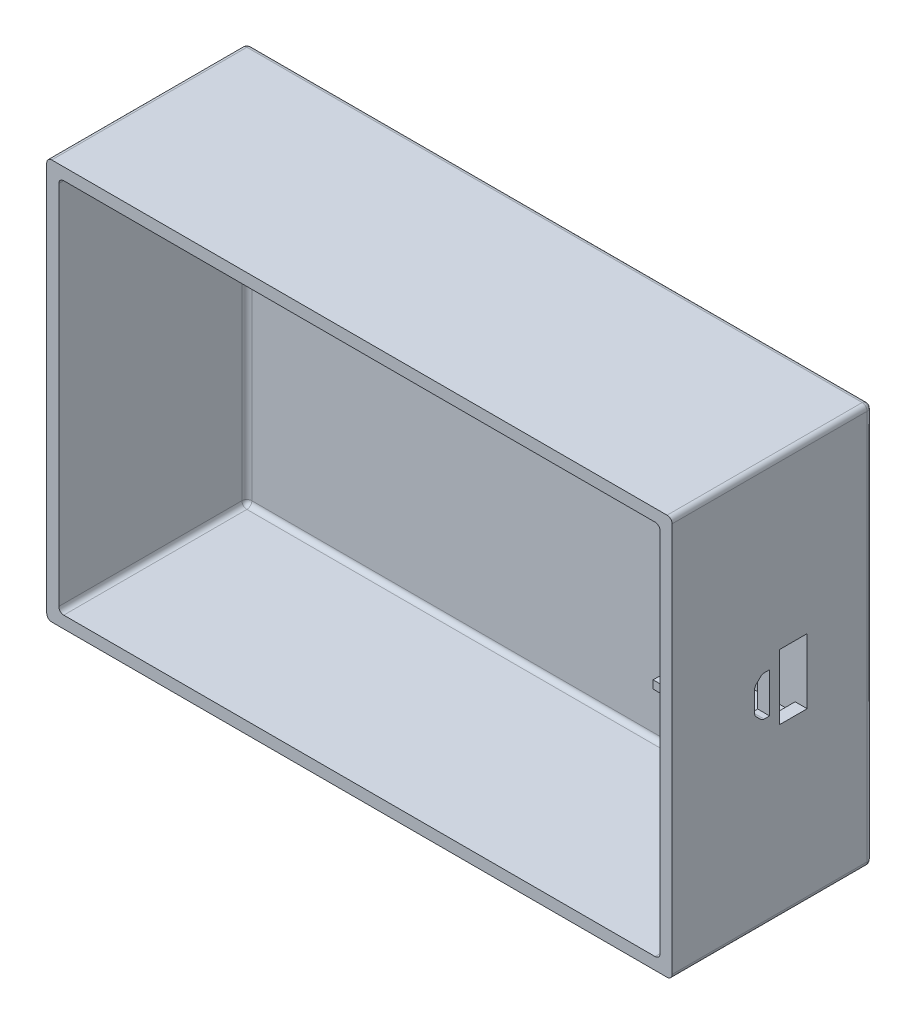
from build123d import *

# Parameters (mm, degrees)
SKETCH_1_W          = 125
SKETCH_1_H          = 80
EXTRUDE_1_DEPTH     = 40
SKETCH_2_W          = 120.2
SKETCH_2_H          = 75.2
CUT_EXTRUDE_1_DEPTH = 37.6
FILLET_1_R          = 1
FILLET_2_R          = 1
CUT_EXTRUDE_2_DEPTH = 0.5
SKETCH_4_W          = 5.5
SKETCH_4_H          = 13
CUT_EXTRUDE_3_DEPTH = 5
EXTRUDE_2_DEPTH     = 20
EXTRUDE_3_DEPTH     = 8


with BuildPart() as part:
    # Эскиз1 → Бобышка-Вытянуть1 (new body)
    with BuildSketch(Plane.XY):
        Rectangle(SKETCH_1_W, SKETCH_1_H)
    extrude(amount=EXTRUDE_1_DEPTH)

    # Эскиз2 → Вырез-Вытянуть1 (cut)
    with BuildSketch(Plane.XY.offset(40)):
        Rectangle(SKETCH_2_W, SKETCH_2_H)
    extrude(amount=-CUT_EXTRUDE_1_DEPTH, mode=Mode.SUBTRACT)

    # Скругление1
    fillet_1_edges = [part.edges().sort_by_distance(p)[0] for p in [
        (0, -40, 0),
        (-62.5, 0, 0),
        (0, 40, 0),
        (62.5, 0, 0),
        (62.5, -40, 20),
        (-62.5, -40, 20),
        (-62.5, 40, 20),
        (62.5, 40, 20),
    ]]
    fillet(fillet_1_edges, radius=FILLET_1_R)

    # Скругление2
    fillet_2_edges = [part.edges().sort_by_distance(p)[0] for p in [
        (60.1, 0, 2.4),
        (60.1, 37.6, 21.2),
        (0, -37.6, 2.4),
        (60.1, -37.6, 21.2),
        (-60.1, 0, 2.4),
        (-60.1, -37.6, 21.2),
        (0, 37.6, 2.4),
        (-60.1, 37.6, 21.2),
    ]]
    fillet(fillet_2_edges, radius=FILLET_2_R)

    # Эскиз3 → Вырез-Вытянуть2 (cut)
    # profile 1 of 6: a face of its own
    with BuildSketch(Plane(origin=(0, 0, 0), x_dir=(-1, 0, 0), z_dir=(0, 0, -1))):
        with BuildLine():
            Line((-35.743589744, 25), (-16.769230769, 25))
            Line((-16.769230769, 25), (-16.769230769, 8.333333333))
            Line((-16.769230769, 8.333333333), (-14.461538462, 8.333333333))
            Line((-14.461538462, 8.333333333), (-14.461538462, 0.641025641))
            Line((-14.461538462, 0.641025641), (-19.076923077, 0.641025641))
            Line((-19.076923077, 0.641025641), (-19.076923077, 5))
            Line((-19.076923077, 5), (-36.256410256, 5))
            Line((-36.256410256, 5), (-36.256410256, 0.641025641))
            Line((-36.256410256, 0.641025641), (-40.871794872, 0.641025641))
            Line((-40.871794872, 0.641025641), (-40.871794872, 8.333333333))
            Line((-40.871794872, 8.333333333), (-38.564102564, 8.333333333))
            add(Edge.make_bspline(
                [(-38.564102564, 8.333333333), (-38.423939227, 8.549412333), (-38.142564623, 8.983185846), (-37.766294395, 9.665700543), (-37.432031298, 10.377061568), (-37.124908802, 11.109271034), (-36.861959465, 11.86880581), (-36.632590424, 12.652158986), (-36.440496869, 13.462613095), (-36.284618524, 14.305421659), (-36.158953799, 15.1895625), (-36.044974298, 16.123005325), (-35.956693481, 17.113449057), (-35.874111033, 18.158890462), (-35.81488608, 19.259665772), (-35.777871569, 20.41649224), (-35.746447147, 21.629106486), (-35.744556365, 22.457242257), (-35.743589744, 22.880608974)],
                knots=[0, 0, 0, 0, 0.821752742, 1.649649308, 2.484634787, 3.329137309, 4.182327301, 5.048164878, 5.93303002, 6.839131783, 7.782388066, 8.782543542, 9.83977442, 10.955378249, 12.129129161, 13.357281614, 14.648966693, 16, 16, 16, 16], degree=3))
            Line((-35.743589744, 22.880608974), (-35.743589744, 25))
        make_face()
        with BuildLine():
            add(Edge.make_bspline(
                [(-30.102564103, 21.666666667), (-30.105207991, 21.29271776), (-30.110411753, 20.556702847), (-30.141427896, 19.471929174), (-30.198903671, 18.424816315), (-30.272504924, 17.415920166), (-30.374193999, 16.446325596), (-30.491872073, 15.51592918), (-30.638063507, 14.625283032), (-30.799382741, 13.771919733), (-30.989770134, 12.957530565), (-31.195203978, 12.179846934), (-31.428955472, 11.442789154), (-31.67921883, 10.743548847), (-31.957780404, 10.085663181), (-32.252123153, 9.463377077), (-32.572763759, 8.880432264), (-32.807560893, 8.513739619), (-32.923076923, 8.333333333)],
                knots=[0, 0, 0, 0, 1.299711557, 2.558122435, 3.771311303, 4.944304467, 6.073539971, 7.159347729, 8.2032346, 9.21003606, 10.177197405, 11.109446499, 12.004918904, 12.86385847, 13.689704149, 14.486931871, 15.255597286, 16, 16, 16, 16], degree=3))
            Line((-32.923076923, 8.333333333), (-22.41025641, 8.333333333))
            Line((-22.41025641, 8.333333333), (-22.41025641, 21.666666667))
            Line((-22.41025641, 21.666666667), (-30.102564103, 21.666666667))
        make_face(mode=Mode.SUBTRACT)
    # profile 2 of 6: a face of its own
    with BuildSketch(Plane(origin=(0, 0, 0), x_dir=(-1, 0, 0), z_dir=(0, 0, -1))):
        with BuildLine():
            Line((-6.769230769, 19.615384615), (10.923076923, 19.615384615))
            Line((10.923076923, 19.615384615), (10.923076923, 5))
            Line((10.923076923, 5), (5.538461538, 5))
            Line((5.538461538, 5), (5.538461538, 16.794871795))
            Line((5.538461538, 16.794871795), (-1.384615385, 16.794871795))
            Line((-1.384615385, 16.794871795), (-1.384615385, 10.048076923))
            add(Edge.make_bspline(
                [(-1.384615385, 10.048076923), (-1.386370161, 9.841005653), (-1.38974751, 9.442463754), (-1.43061393, 8.870145363), (-1.494144698, 8.34584416), (-1.579398924, 7.868380094), (-1.695415169, 7.438246181), (-1.834985273, 7.055656363), (-1.996839462, 6.717891165), (-2.252556904, 6.348388821), (-2.599413454, 5.95961178), (-3.040930933, 5.569462975), (-3.506716493, 5.266068316), (-3.922573615, 5.087374577), (-4.279996587, 4.985410882), (-4.584520837, 4.923820444), (-4.925339923, 4.868085771), (-5.303339715, 4.819468858), (-5.719065582, 4.784317372), (-6.173424849, 4.761999434), (-6.66492972, 4.74448371), (-7.005591152, 4.743894614), (-7.181891026, 4.743589744)],
                knots=[0, 0, 0, 0, 1.340868013, 2.580715734, 3.713588199, 4.760277271, 5.719123454, 6.594782291, 7.395470463, 8.136727625, 9.497147129, 10.759921788, 11.942705723, 13.081801271, 13.675827936, 14.347571739, 15.09265399, 15.912271391, 16.815144, 17.793873759, 18.858280561, 20, 20, 20, 20], degree=3))
            add(Edge.make_bspline(
                [(-7.181891026, 4.743589744), (-7.415650966, 4.747392526), (-7.919565879, 4.755590162), (-8.726395682, 4.803139599), (-9.6373807, 4.875198272), (-10.277639615, 4.941163836), (-10.615384615, 4.975961538)],
                knots=[0, 0, 0, 0, 0.814839079, 1.756543752, 2.816547317, 4, 4, 4, 4], degree=3))
            Line((-10.615384615, 4.975961538), (-10.615384615, 7.632211538))
            add(Edge.make_bspline(
                [(-10.615384615, 7.632211538), (-10.573976604, 7.632599088), (-10.46839733, 7.633587234), (-10.274920677, 7.621528064), (-10.01169784, 7.616593056), (-9.812753781, 7.60861256), (-9.701923077, 7.604166667)],
                knots=[0, 0, 0, 0, 0.543558918, 1.385928807, 2.543714495, 4, 4, 4, 4], degree=3))
            add(Edge.make_bspline(
                [(-9.701923077, 7.604166667), (-9.567046398, 7.598670355), (-9.314677242, 7.588386148), (-8.959441482, 7.576196167), (-8.653612273, 7.567804294), (-8.465281239, 7.565258133), (-8.379807692, 7.564102564)],
                knots=[0, 0, 0, 0, 1.224593261, 2.291349178, 3.224533305, 4, 4, 4, 4], degree=3))
            add(Edge.make_bspline(
                [(-8.379807692, 7.564102564), (-8.291590958, 7.565426279), (-8.124143446, 7.567938873), (-7.887114826, 7.592227139), (-7.675268101, 7.629808654), (-7.492442649, 7.691413303), (-7.330943187, 7.760407834), (-7.202745141, 7.855983674), (-7.092779049, 7.959939288), (-7.013277733, 8.094684363), (-6.952603688, 8.265829128), (-6.902374207, 8.486265686), (-6.866005406, 8.765472969), (-6.829145485, 9.100603944), (-6.8024436, 9.494898751), (-6.782984025, 9.947747754), (-6.77124658, 10.459341107), (-6.769925485, 10.819972464), (-6.769230769, 11.009615385)],
                knots=[0, 0, 0, 0, 0.945825259, 1.795306607, 2.553808499, 3.246864566, 3.862134721, 4.426621001, 4.953312137, 5.474127026, 6.086053296, 6.895587344, 7.894276821, 9.104388665, 10.511727968, 12.131936209, 13.965925869, 16, 16, 16, 16], degree=3))
            Line((-6.769230769, 11.009615385), (-6.769230769, 19.615384615))
        make_face()
    # profile 3 of 6: a face of its own
    with BuildSketch(Plane(origin=(0, 0, 0), x_dir=(-1, 0, 0), z_dir=(0, 0, -1))):
        with BuildLine():
            Line((36.307692308, 19.615384615), (36.307692308, 5))
            Line((36.307692308, 5), (30.923076923, 5))
            Line((30.923076923, 5), (30.923076923, 10.897435897))
            Line((30.923076923, 10.897435897), (30.442307692, 10.897435897))
            add(Edge.make_bspline(
                [(30.442307692, 10.897435897), (30.307399621, 10.897151422), (30.046826075, 10.896601959), (29.670188735, 10.878786198), (29.321149692, 10.857179984), (28.999333026, 10.819720812), (28.705075449, 10.777158295), (28.437287536, 10.725270029), (28.1980981, 10.663527257), (27.910508572, 10.557392241), (27.557194418, 10.378942568), (27.133007286, 10.085344805), (26.686965142, 9.704754922), (26.39738786, 9.40826878), (26.243589744, 9.250801282)],
                knots=[0, 0, 0, 0, 1.033741574, 1.996661172, 2.889183176, 3.71311321, 4.478792633, 5.167252479, 5.802785083, 6.36939551, 7.51365449, 8.825117058, 10.313779961, 12, 12, 12, 12], degree=3))
            Line((26.243589744, 9.250801282), (25.931089744, 8.970352564))
            Line((25.931089744, 8.970352564), (22.521634615, 5))
            Line((22.521634615, 5), (16.051282051, 5))
            Line((16.051282051, 5), (19.869391026, 9.118589744))
            add(Edge.make_bspline(
                [(19.869391026, 9.118589744), (20.001762801, 9.261255835), (20.258115196, 9.537544298), (20.648290221, 9.919420288), (21.035634938, 10.247074836), (21.405655041, 10.535862655), (21.773494046, 10.768929021), (22.128906731, 10.958260179), (22.475435678, 11.10435537), (22.709047041, 11.162002517), (22.822115385, 11.189903846)],
                knots=[0, 0, 0, 0, 1.275536761, 2.470216209, 3.575314176, 4.599451856, 5.544004934, 6.42497539, 7.237685091, 8, 8, 8, 8], degree=3))
            add(Edge.make_bspline(
                [(22.822115385, 11.189903846), (22.641518472, 11.200241167), (22.288285741, 11.220460118), (21.773845596, 11.301149545), (21.282393179, 11.401534395), (20.81805521, 11.543209505), (20.37800364, 11.713617163), (19.969160249, 11.925493152), (19.580470911, 12.161093522), (19.222284482, 12.432368704), (18.899138247, 12.729511223), (18.619134069, 13.05196172), (18.376047618, 13.389995098), (18.185803336, 13.754766021), (18.028156058, 14.132619326), (17.928534492, 14.535482873), (17.854749614, 14.954564262), (17.849043353, 15.242711354), (17.846153846, 15.388621795)],
                knots=[0, 0, 0, 0, 1.197713301, 2.342628858, 3.446289809, 4.518324156, 5.55505531, 6.568031173, 7.564999682, 8.563027648, 9.539728277, 10.46776829, 11.388312886, 12.290779309, 13.187851591, 14.093478572, 15.034585495, 16, 16, 16, 16], degree=3))
            add(Edge.make_bspline(
                [(17.846153846, 15.388621795), (17.84986642, 15.506235897), (17.857186009, 15.73812003), (17.896227608, 16.080488652), (17.968262298, 16.410881405), (18.073773969, 16.726258135), (18.202255675, 17.029857481), (18.359145211, 17.320545393), (18.547830608, 17.596518448), (18.838471569, 17.944606589), (19.259410649, 18.338104616), (19.843541411, 18.72862787), (20.501337161, 19.041753739), (21.110327599, 19.222558711), (21.645005762, 19.336751114), (22.099600849, 19.412413265), (22.599513637, 19.475425061), (23.145997462, 19.527078884), (23.739177239, 19.566924409), (24.379122479, 19.592605917), (25.065544672, 19.61566154), (25.538438959, 19.615478974), (25.782852564, 19.615384615)],
                knots=[0, 0, 0, 0, 0.696101467, 1.37241099, 2.03580972, 2.693014292, 3.337361357, 3.984416181, 4.644133792, 5.311895028, 6.664837187, 8.03682209, 9.4542059, 10.958925535, 11.783473158, 12.688943128, 13.684762593, 14.764344718, 15.936519858, 17.202062861, 18.553896884, 20, 20, 20, 20], degree=3))
            Line((25.782852564, 19.615384615), (36.307692308, 19.615384615))
        make_face()
        with BuildLine():
            Line((30.923076923, 17.051282051), (27.076923077, 17.051282051))
            add(Edge.make_bspline(
                [(27.076923077, 17.051282051), (26.905996475, 17.048899722), (26.578760076, 17.044338788), (26.106606943, 17.033184254), (25.675641451, 16.992752503), (25.281631588, 16.953966909), (24.9285937, 16.889575039), (24.611175678, 16.828965569), (24.337725871, 16.735931207), (24.097316825, 16.6437899), (23.892923626, 16.527820601), (23.715280376, 16.40056762), (23.563194765, 16.254958495), (23.443354858, 16.087761874), (23.345189571, 15.906732234), (23.277389431, 15.707733437), (23.235972557, 15.491851364), (23.232545914, 15.342078774), (23.230769231, 15.264423077)],
                knots=[0, 0, 0, 0, 1.72653821, 3.305431345, 4.767069014, 6.097088554, 7.301057069, 8.390914795, 9.354829622, 10.213874238, 10.986759081, 11.720527595, 12.416772168, 13.101956177, 13.789789786, 14.489292424, 15.216712155, 16, 16, 16, 16], degree=3))
            add(Edge.make_bspline(
                [(23.230769231, 15.264423077), (23.234066472, 15.186774114), (23.24048918, 15.03552144), (23.283967448, 14.817271269), (23.361319764, 14.616667262), (23.471675391, 14.43534563), (23.609450095, 14.267853127), (23.780302633, 14.120617549), (23.977909147, 13.98586699), (24.21172281, 13.875246803), (24.476496024, 13.774402013), (24.781436543, 13.691357307), (25.124210356, 13.621164406), (25.505024382, 13.560392522), (25.923798032, 13.518284817), (26.380747422, 13.486536424), (26.877767111, 13.46659453), (27.222470584, 13.463266428), (27.401442308, 13.461538462)],
                knots=[0, 0, 0, 0, 0.738505747, 1.438537798, 2.106124022, 2.772742729, 3.449332141, 4.160342169, 4.910768808, 5.717464319, 6.613971556, 7.603314207, 8.719416959, 9.941122083, 11.269570315, 12.721237693, 14.297650627, 16, 16, 16, 16], degree=3))
            Line((27.401442308, 13.461538462), (30.923076923, 13.461538462))
            Line((30.923076923, 13.461538462), (30.923076923, 17.051282051))
        make_face(mode=Mode.SUBTRACT)
    # profile 4 of 6: a face of its own
    with BuildSketch(Plane(origin=(0, 0, 0), x_dir=(-1, 0, 0), z_dir=(0, 0, -1))):
        with BuildLine():
            Line((-34.717948718, -13.435897436), (-40.358974359, -12.41025641))
            add(Edge.make_bspline(
                [(-40.358974359, -12.41025641), (-40.279888714, -12.212281851), (-40.123180431, -11.819995065), (-39.824596185, -11.264789738), (-39.473257502, -10.748721575), (-39.071886882, -10.269382885), (-38.615068822, -9.832608888), (-38.112910799, -9.428726776), (-37.555504013, -9.068543612), (-36.950048281, -8.743834924), (-36.291523478, -8.459016914), (-35.583204479, -8.211470242), (-34.823441259, -8.00531936), (-34.014729969, -7.831199531), (-33.153988448, -7.702683564), (-32.242502948, -7.605647167), (-31.279796888, -7.550450104), (-30.620794788, -7.542525399), (-30.282852564, -7.538461538)],
                knots=[0, 0, 0, 0, 0.854963274, 1.694110579, 2.523498924, 3.356480554, 4.197849411, 5.055696551, 5.938603418, 6.856874247, 7.809648952, 8.814687402, 9.865160438, 10.966677751, 12.132340193, 13.355597085, 14.64392632, 16, 16, 16, 16], degree=3))
            add(Edge.make_bspline(
                [(-30.282852564, -7.538461538), (-29.886140206, -7.543327819), (-29.116143664, -7.552772997), (-27.997901433, -7.618209544), (-26.955224811, -7.739470356), (-25.986985253, -7.899852711), (-25.095936172, -8.112834478), (-24.277433799, -8.364925409), (-23.537251789, -8.675528927), (-22.871834144, -9.02543604), (-22.287338367, -9.412388921), (-21.772813101, -9.811748302), (-21.339189582, -10.23250413), (-20.978426207, -10.667325297), (-20.704840189, -11.123900015), (-20.502714606, -11.594339884), (-20.382928814, -12.085145966), (-20.366979876, -12.418974385), (-20.358974359, -12.586538462)],
                knots=[0, 0, 0, 0, 1.560831493, 3.029486796, 4.404656358, 5.689125062, 6.888349997, 8.006716197, 9.054738793, 10.041923272, 10.960020323, 11.809342296, 12.600783475, 13.332767086, 14.025711206, 14.687350788, 15.341120049, 16, 16, 16, 16], degree=3))
            add(Edge.make_bspline(
                [(-20.358974359, -12.586538462), (-20.361337627, -12.701638042), (-20.366038518, -12.93058812), (-20.425728987, -13.267345057), (-20.515382796, -13.595333055), (-20.632566215, -13.917726506), (-20.798631199, -14.226638168), (-20.988353184, -14.532584419), (-21.220311722, -14.825826159), (-21.485612679, -15.11118187), (-21.787558943, -15.386059219), (-22.119902697, -15.656690099), (-22.492637343, -15.91129771), (-22.895298726, -16.165518825), (-23.339623606, -16.403309814), (-23.81465449, -16.641501272), (-24.328169129, -16.864052443), (-24.684103449, -17.002760293), (-24.866185897, -17.073717949)],
                knots=[0, 0, 0, 0, 0.814746678, 1.620651567, 2.414971373, 3.223538951, 4.044690925, 4.89535986, 5.771851774, 6.689232278, 7.6536808, 8.663137878, 9.723733213, 10.850255578, 12.03603721, 13.293018467, 14.615211302, 16, 16, 16, 16], degree=3))
            add(Edge.make_bspline(
                [(-24.866185897, -17.073717949), (-24.642551872, -17.131658106), (-24.205869802, -17.244795754), (-23.578112664, -17.446110324), (-22.992175464, -17.66164215), (-22.449180638, -17.892924114), (-21.95077366, -18.145040118), (-21.497166871, -18.417448588), (-21.086618975, -18.70733332), (-20.714897212, -19.010593311), (-20.390091893, -19.336418248), (-20.105499414, -19.678060634), (-19.870184027, -20.041539283), (-19.668033888, -20.419573496), (-19.523715731, -20.821847659), (-19.41414188, -21.238508906), (-19.342207847, -21.673265842), (-19.336324836, -21.970600609), (-19.333333333, -22.121794872)],
                knots=[0, 0, 0, 0, 1.363670452, 2.66278996, 3.890135407, 5.048615163, 6.145236149, 7.185059184, 8.169449617, 9.110314329, 10.013489942, 10.881676504, 11.73016355, 12.565953945, 13.406638985, 14.246177088, 15.108183796, 16, 16, 16, 16], degree=3))
            add(Edge.make_bspline(
                [(-19.333333333, -22.121794872), (-19.34219292, -22.338721231), (-19.359623789, -22.765514816), (-19.486158134, -23.389801465), (-19.699655411, -23.979815894), (-20.003479317, -24.535722537), (-20.384808741, -25.063023406), (-20.856483893, -25.554068042), (-21.410048049, -26.011750477), (-22.045952332, -26.436069992), (-22.763856152, -26.823231581), (-23.572827995, -27.146506025), (-24.457746674, -27.43329656), (-25.430352003, -27.656961645), (-26.483986126, -27.839018077), (-27.623277698, -27.955489165), (-28.844573529, -28.041589814), (-29.68706099, -28.04797905), (-30.122596154, -28.051282051)],
                knots=[0, 0, 0, 0, 0.761550587, 1.498319087, 2.226800592, 2.957091617, 3.716052601, 4.505611972, 5.341521545, 6.233879613, 7.186530315, 8.200336361, 9.2890326, 10.450538317, 11.701968329, 13.041876955, 14.470758718, 16, 16, 16, 16], degree=3))
            add(Edge.make_bspline(
                [(-30.122596154, -28.051282051), (-30.47922512, -28.048399954), (-31.172791318, -28.042794897), (-32.184367883, -27.993865829), (-33.137399769, -27.915524456), (-34.034333551, -27.803358598), (-34.873131887, -27.661663465), (-35.654354556, -27.485444483), (-36.377148558, -27.277753748), (-37.048641559, -27.038183079), (-37.672738835, -26.754372324), (-38.249594856, -26.409118161), (-38.790643325, -26.012474382), (-39.285470856, -25.55254762), (-39.74774232, -25.043665106), (-40.168053679, -24.477778506), (-40.546671206, -23.85275982), (-40.761891227, -23.407077863), (-40.871794872, -23.179487179)],
                knots=[0, 0, 0, 0, 1.358105267, 2.641220975, 3.855947254, 4.999023033, 6.082656065, 7.094392619, 8.047302311, 8.945029315, 9.807501762, 10.653577828, 11.500921721, 12.357601304, 13.221796556, 14.115914563, 15.037878278, 16, 16, 16, 16], degree=3))
            Line((-40.871794872, -23.179487179), (-35.230769231, -21.897435897))
            add(Edge.make_bspline(
                [(-35.230769231, -21.897435897), (-35.164864579, -22.040119435), (-35.036972508, -22.317005702), (-34.814744291, -22.701250926), (-34.582508183, -23.050670382), (-34.330222025, -23.359269716), (-34.061252106, -23.630105247), (-33.775832347, -23.859067351), (-33.475589585, -24.051480288), (-33.045322492, -24.254715491), (-32.455463654, -24.443407345), (-31.690741244, -24.599458273), (-30.851890457, -24.703206088), (-30.267159797, -24.712896899), (-29.962339744, -24.717948718)],
                knots=[0, 0, 0, 0, 0.879662781, 1.707040261, 2.48275382, 3.226747029, 3.935320759, 4.616203792, 5.271770941, 5.92733809, 7.275276667, 8.727274345, 10.293928337, 12, 12, 12, 12], degree=3))
            add(Edge.make_bspline(
                [(-29.962339744, -24.717948718), (-29.752607711, -24.716081473), (-29.34741697, -24.712474058), (-28.761517863, -24.672552788), (-28.219962365, -24.604443165), (-27.721504422, -24.514248792), (-27.267648765, -24.396277968), (-26.859942466, -24.245683633), (-26.491954415, -24.076684888), (-26.171812783, -23.87334195), (-25.889092423, -23.65828825), (-25.649755199, -23.426688897), (-25.437899403, -23.196594121), (-25.267641815, -22.954451306), (-25.138000643, -22.703265605), (-25.045081142, -22.444727275), (-24.986547665, -22.177803472), (-24.978436124, -21.996552113), (-24.974358974, -21.905448718)],
                knots=[0, 0, 0, 0, 1.589407083, 3.070646972, 4.447876576, 5.724383153, 6.907764151, 7.996500943, 9.015235275, 9.97012061, 10.86496701, 11.702630916, 12.491089718, 13.232400992, 13.938607157, 14.62696155, 15.309861917, 16, 16, 16, 16], degree=3))
            add(Edge.make_bspline(
                [(-24.974358974, -21.905448718), (-24.977185169, -21.800812842), (-24.982721604, -21.595834118), (-25.057033741, -21.298463192), (-25.163837937, -21.015305327), (-25.318548133, -20.746791529), (-25.522022155, -20.499046745), (-25.766027972, -20.264659447), (-26.050841997, -20.043795869), (-26.382146941, -19.843828141), (-26.756950734, -19.664570721), (-27.173878886, -19.502838344), (-27.639116601, -19.373945918), (-28.145430623, -19.260748798), (-28.698552892, -19.17857874), (-29.293548726, -19.119746255), (-29.933839129, -19.083141737), (-30.374949313, -19.07904464), (-30.603365385, -19.076923077)],
                knots=[0, 0, 0, 0, 0.720237758, 1.410925408, 2.102288907, 2.8040751, 3.53803513, 4.307024266, 5.134623217, 6.019637888, 6.971676192, 7.998466297, 9.100947845, 10.299346042, 11.576533089, 12.956493832, 14.424008909, 16, 16, 16, 16], degree=3))
            Line((-30.603365385, -19.076923077), (-31.897435897, -19.076923077))
            Line((-31.897435897, -19.076923077), (-31.897435897, -16.256410256))
            Line((-31.897435897, -16.256410256), (-31.260416667, -16.256410256))
            add(Edge.make_bspline(
                [(-31.260416667, -16.256410256), (-31.053371951, -16.254163917), (-30.652303845, -16.249812515), (-30.06912, -16.214628737), (-29.523538808, -16.15063126), (-29.015571754, -16.062395287), (-28.543382717, -15.956297153), (-28.10955251, -15.821818016), (-27.716184058, -15.655005569), (-27.356740735, -15.473621183), (-27.04071896, -15.263618195), (-26.761441834, -15.040934281), (-26.527379751, -14.797556202), (-26.330712732, -14.542186656), (-26.187161753, -14.263481765), (-26.076168964, -13.974266207), (-26.010242498, -13.665870219), (-26.003449891, -13.454903902), (-26, -13.34775641)],
                knots=[0, 0, 0, 0, 1.49029937, 2.886871774, 4.203260901, 5.442298604, 6.596583465, 7.685023486, 8.706224579, 9.669304773, 10.578486423, 11.432749348, 12.234962671, 13.00400541, 13.743647033, 14.482851238, 15.229456688, 16, 16, 16, 16], degree=3))
            add(Edge.make_bspline(
                [(-26, -13.34775641), (-26.002657045, -13.262006039), (-26.007898417, -13.092852173), (-26.062693177, -12.844395413), (-26.151326328, -12.607521106), (-26.273020507, -12.381463295), (-26.427682447, -12.164618374), (-26.622509455, -11.962580188), (-26.84674032, -11.76554819), (-27.104228296, -11.58164944), (-27.392348739, -11.411962923), (-27.715000963, -11.270323592), (-28.063833247, -11.144754497), (-28.443740911, -11.046212492), (-28.851598414, -10.965803586), (-29.29064645, -10.910454572), (-29.758891281, -10.879344098), (-30.081149732, -10.874357863), (-30.246794872, -10.871794872)],
                knots=[0, 0, 0, 0, 0.755897194, 1.491106475, 2.233369413, 2.982248597, 3.750996372, 4.576569761, 5.453718901, 6.382796318, 7.365372167, 8.399486862, 9.488193061, 10.634773957, 11.860034556, 13.155469815, 14.53787356, 16, 16, 16, 16], degree=3))
            add(Edge.make_bspline(
                [(-30.246794872, -10.871794872), (-30.525046884, -10.878791792), (-31.059003616, -10.892218658), (-31.820905554, -11.01278056), (-32.505985972, -11.210248997), (-33.112579876, -11.492918138), (-33.642114412, -11.856230487), (-34.089106085, -12.304751844), (-34.457900174, -12.833933767), (-34.629878846, -13.23203218), (-34.717948718, -13.435897436)],
                knots=[0, 0, 0, 0, 1.208751061, 2.319554717, 3.342564807, 4.298139982, 5.215927623, 6.118911266, 7.036698907, 8, 8, 8, 8], degree=3))
        make_face()
    # profile 5 of 6: a face of its own
    with BuildSketch(Plane(origin=(0, 0, 0), x_dir=(-1, 0, 0), z_dir=(0, 0, -1))):
        with BuildLine():
            Line((5.538461538, -20.358974359), (10.923076923, -21.641025641))
            add(Edge.make_bspline(
                [(10.923076923, -21.641025641), (10.81529284, -21.894182514), (10.602316992, -22.39440758), (10.209502766, -23.101079081), (9.769395007, -23.76078208), (9.274710933, -24.368887236), (8.726284423, -24.922721266), (8.130385764, -25.432019635), (7.480276617, -25.887854403), (6.778558823, -26.293771349), (6.028548068, -26.650981465), (5.226982721, -26.953172239), (4.380512144, -27.215056525), (3.483102818, -27.425054742), (2.539333377, -27.594899142), (1.544863591, -27.706984942), (0.503565425, -27.782201779), (-0.207925898, -27.790588399), (-0.571314103, -27.794871795)],
                knots=[0, 0, 0, 0, 0.947346957, 1.871909256, 2.78043276, 3.676452459, 4.567853774, 5.462099994, 6.373461405, 7.299076215, 8.251881505, 9.231922012, 10.247692588, 11.302232216, 12.405063169, 13.54924748, 14.748298777, 16, 16, 16, 16], degree=3))
            add(Edge.make_bspline(
                [(-0.571314103, -27.794871795), (-1.020371377, -27.788263465), (-1.900374344, -27.775313335), (-3.189268194, -27.641914822), (-4.417310043, -27.436394049), (-5.586875999, -27.149031652), (-6.692411397, -26.772728533), (-7.738187396, -26.313290823), (-8.722646169, -25.772706036), (-9.489182, -25.25034721), (-10.063213062, -24.796675284), (-10.46421467, -24.437892061), (-10.842333301, -24.068092336), (-11.185290816, -23.675873023), (-11.509188937, -23.277547156), (-11.79674912, -22.857059356), (-12.062660639, -22.425114423), (-12.299239976, -21.975257008), (-12.507045242, -21.51058088), (-12.688372592, -21.031882176), (-12.841432239, -20.536916696), (-12.963593763, -20.026725743), (-13.061840582, -19.501360142), (-13.126930322, -18.960618073), (-13.1749811, -18.404706105), (-13.177975942, -18.028686761), (-13.179487179, -17.838942308)],
                knots=[0, 0, 0, 0, 1.791237332, 3.510229671, 5.16418935, 6.756428933, 8.310109429, 9.818019681, 11.308628788, 12.785141417, 13.513323979, 14.226674063, 14.931293169, 15.622074919, 16.304481995, 16.97851566, 17.652970464, 18.327530513, 19.004925963, 19.682866128, 20.368863042, 21.070655585, 21.775093325, 22.500149618, 23.243155183, 24, 24, 24, 24], degree=3))
            add(Edge.make_bspline(
                [(-13.179487179, -17.838942308), (-13.177994221, -17.638520227), (-13.175044288, -17.242506874), (-13.127030177, -16.657207517), (-13.061192554, -16.087290861), (-12.965191896, -15.534789553), (-12.840681266, -14.999765615), (-12.688337376, -14.482028012), (-12.508150802, -13.980130694), (-12.299242377, -13.496598546), (-12.067617902, -13.027527323), (-11.800426566, -12.580900187), (-11.514658858, -12.144605776), (-11.189363138, -11.733702311), (-10.847526003, -11.331275915), (-10.473649574, -10.950155812), (-10.06968618, -10.589396427), (-9.499127495, -10.123172745), (-8.724126748, -9.597567618), (-7.732888216, -9.040531459), (-6.667700521, -8.575605295), (-5.534495436, -8.195649971), (-4.331057145, -7.899624825), (-3.058791077, -7.688631343), (-1.71694851, -7.564538493), (-0.799941642, -7.547285666), (-0.330929487, -7.538461538)],
                knots=[0, 0, 0, 0, 0.77664363, 1.53456768, 2.274892301, 2.999984421, 3.706925311, 4.403075492, 5.090802435, 5.772561366, 6.443923248, 7.116879817, 7.788800269, 8.463923535, 9.146684028, 9.834878389, 10.531317209, 11.245198673, 12.689680356, 14.15432575, 15.647051531, 17.187458641, 18.781957291, 20.445713313, 22.182125224, 24, 24, 24, 24], degree=3))
            add(Edge.make_bspline(
                [(-0.330929487, -7.538461538), (0.079234612, -7.545920299), (0.882111914, -7.560520479), (2.056397958, -7.658792905), (3.170546607, -7.833336156), (4.227473367, -8.065284509), (5.225083333, -8.375825904), (6.163932836, -8.751225104), (7.045823013, -9.194847745), (7.588806649, -9.549849993), (7.858173077, -9.725961538)],
                knots=[0, 0, 0, 0, 1.143684331, 2.238709315, 3.282544038, 4.286232804, 5.25321281, 6.192249358, 7.10320072, 8, 8, 8, 8], degree=3))
            add(Edge.make_bspline(
                [(7.858173077, -9.725961538), (8.01105294, -9.836969592), (8.317110581, -10.059202019), (8.740548416, -10.437684201), (9.135425873, -10.850117433), (9.506412255, -11.29437436), (9.841576261, -11.779979349), (10.144581056, -12.300546434), (10.430796481, -12.849622639), (10.58709688, -13.238120169), (10.666666667, -13.435897436)],
                knots=[0, 0, 0, 0, 0.959372778, 1.920615073, 2.880323673, 3.858489671, 4.857885176, 5.873727477, 6.917552015, 8, 8, 8, 8], degree=3))
            Line((10.666666667, -13.435897436), (5.282051282, -14.205128205))
            add(Edge.make_bspline(
                [(5.282051282, -14.205128205), (5.237718519, -14.078629948), (5.149698829, -13.827476248), (4.975399199, -13.468787551), (4.767365777, -13.13171712), (4.522818976, -12.817653932), (4.25209374, -12.518374711), (3.938702006, -12.247648427), (3.599305249, -11.988148184), (3.222469204, -11.759406292), (2.820949592, -11.550649265), (2.397628263, -11.365551348), (1.950735875, -11.21403121), (1.483173256, -11.090752041), (0.995578124, -10.988336248), (0.484968036, -10.92435963), (-0.04421476, -10.876019539), (-0.40426051, -10.873218943), (-0.587339744, -10.871794872)],
                knots=[0, 0, 0, 0, 0.889498384, 1.76603865, 2.642130213, 3.514804097, 4.406024819, 5.317012614, 6.260567101, 7.240067246, 8.23959494, 9.264297334, 10.304726928, 11.369512207, 12.473887005, 13.61016531, 14.784795815, 16, 16, 16, 16], degree=3))
            add(Edge.make_bspline(
                [(-0.587339744, -10.871794872), (-0.839984004, -10.875623477), (-1.333128113, -10.883096648), (-2.054188853, -10.964406562), (-2.739825395, -11.07977313), (-3.389164767, -11.252542065), (-3.998884287, -11.479099888), (-4.576874528, -11.74591799), (-5.114686119, -12.069510872), (-5.61873797, -12.436459126), (-6.075890079, -12.860384378), (-6.466506874, -13.353172632), (-6.802327831, -13.902475841), (-7.074019119, -14.514254313), (-7.280769125, -15.187443868), (-7.433592223, -15.91937315), (-7.519065924, -16.713792899), (-7.531862239, -17.263156998), (-7.538461538, -17.546474359)],
                knots=[0, 0, 0, 0, 1.101135447, 2.149340177, 3.160311962, 4.130706059, 5.073989307, 5.993572482, 6.902361748, 7.806156036, 8.708373151, 9.611435522, 10.539223606, 11.508883602, 12.521849135, 13.604522201, 14.764607206, 16, 16, 16, 16], degree=3))
            add(Edge.make_bspline(
                [(-7.538461538, -17.546474359), (-7.534294945, -17.847239509), (-7.526254964, -18.427604725), (-7.43080801, -19.263307368), (-7.286096565, -20.033753933), (-7.07902361, -20.738161155), (-6.811279272, -21.376848613), (-6.480850468, -21.94607213), (-6.093281001, -22.45187045), (-5.640172209, -22.884497205), (-5.140596549, -23.25493376), (-4.607276454, -23.579632329), (-4.036990407, -23.85000153), (-3.432224287, -24.07778944), (-2.789922556, -24.247122539), (-2.11359739, -24.370935827), (-1.40249555, -24.449596853), (-0.916075135, -24.457499471), (-0.667467949, -24.461538462)],
                knots=[0, 0, 0, 0, 1.292726868, 2.494483508, 3.611725173, 4.660121096, 5.64567175, 6.582361598, 7.482918392, 8.376416499, 9.266531008, 10.15291422, 11.057052642, 11.976526345, 12.927957669, 13.909014194, 14.931306992, 16, 16, 16, 16], degree=3))
            add(Edge.make_bspline(
                [(-0.667467949, -24.461538462), (-0.483114859, -24.458019517), (-0.119225517, -24.451073572), (0.416656088, -24.409388335), (0.932488317, -24.326394455), (1.42781384, -24.21969053), (1.90566988, -24.084079438), (2.360054266, -23.911198658), (2.796889731, -23.709679035), (3.212855584, -23.477948335), (3.607671195, -23.215470171), (3.969827684, -22.910239051), (4.308224255, -22.575159578), (4.611793625, -22.199264402), (4.891547516, -21.791994903), (5.138192713, -21.347465428), (5.355851116, -20.866958976), (5.476683805, -20.5308273), (5.538461538, -20.358974359)],
                knots=[0, 0, 0, 0, 1.1029479, 2.177077609, 3.212079838, 4.225930326, 5.206987281, 6.180370042, 7.13116421, 8.082495246, 9.026417573, 9.962361276, 10.911408523, 11.870922843, 12.848133906, 13.863871214, 14.907868427, 16, 16, 16, 16], degree=3))
        make_face()
    # profile 6 of 6: a face of its own
    with BuildSketch(Plane(origin=(0, 0, 0), x_dir=(-1, 0, 0), z_dir=(0, 0, -1))):
        with BuildLine():
            Line((15.41025641, -7.794871795), (21.748397436, -7.794871795))
            Line((21.748397436, -7.794871795), (28.310897436, -17.758814103))
            Line((28.310897436, -17.758814103), (33.350961538, -7.794871795))
            Line((33.350961538, -7.794871795), (39.512820513, -7.794871795))
            Line((39.512820513, -7.794871795), (30.117788462, -22.999198718))
            add(Edge.make_bspline(
                [(30.117788462, -22.999198718), (29.992209817, -23.200347754), (29.746967868, -23.593170768), (29.365167852, -24.156068006), (28.980281927, -24.680170575), (28.596473481, -25.171274028), (28.207105196, -25.622835091), (27.820488883, -26.042295889), (27.425595935, -26.417486711), (27.033106201, -26.764782101), (26.619856016, -27.067000287), (26.186173879, -27.336034792), (25.718443171, -27.555096654), (25.223017781, -27.734528279), (24.700207428, -27.881711147), (24.147107323, -27.978166053), (23.566080793, -28.040748129), (23.169509709, -28.047713625), (22.966346154, -28.051282051)],
                knots=[0, 0, 0, 0, 1.232160985, 2.406281437, 3.533355889, 4.610685078, 5.644162742, 6.631087789, 7.573455428, 8.473717721, 9.352321608, 10.230678799, 11.121584392, 12.030498006, 12.966610129, 13.939874995, 14.944596977, 16, 16, 16, 16], degree=3))
            add(Edge.make_bspline(
                [(22.966346154, -28.051282051), (22.767356873, -28.050527069), (22.381359089, -28.049062559), (21.817688396, -28.037353529), (21.288929896, -28.015848871), (20.791690334, -27.995173079), (20.329934683, -27.956138907), (19.899158632, -27.919664577), (19.502851889, -27.865814649), (19.249666529, -27.825994209), (19.128205128, -27.806891026)],
                knots=[0, 0, 0, 0, 1.240388216, 2.406094951, 3.514044289, 4.539183369, 5.507735045, 6.402345096, 7.233552038, 8, 8, 8, 8], degree=3))
            Line((19.128205128, -27.806891026), (19.128205128, -24.665865385))
            add(Edge.make_bspline(
                [(19.128205128, -24.665865385), (19.488724158, -24.681562697), (20.172178471, -24.711320894), (20.856256967, -24.715821949), (21.179487179, -24.717948718)],
                knots=[0, 0, 0, 0, 1.054990869, 2, 2, 2, 2], degree=3))
            add(Edge.make_bspline(
                [(21.179487179, -24.717948718), (21.327782854, -24.716910371), (21.615313999, -24.714897116), (22.029639302, -24.685396458), (22.412647851, -24.64377227), (22.760400352, -24.579387943), (23.077188612, -24.50023493), (23.36012242, -24.400929818), (23.61277231, -24.285454693), (23.835657941, -24.144574391), (24.043227812, -23.975333517), (24.237680391, -23.7629762), (24.434665998, -23.514882612), (24.625358429, -23.223402005), (24.819485824, -22.894612681), (25.004505309, -22.520385738), (25.19535158, -22.107714631), (25.31033539, -21.813971192), (25.370192308, -21.661057692)],
                knots=[0, 0, 0, 0, 1.247011666, 2.417836479, 3.492055037, 4.485672522, 5.390151663, 6.235655022, 7.004487728, 7.721259572, 8.447561398, 9.250116621, 10.13776972, 11.109755632, 12.177022009, 13.347469597, 14.61917696, 16, 16, 16, 16], degree=3))
            Line((25.370192308, -21.661057692), (15.41025641, -7.794871795))
        make_face()
    extrude(amount=-CUT_EXTRUDE_2_DEPTH, mode=Mode.SUBTRACT)

    # Эскиз4 → Вырез-Вытянуть3 (cut)
    with BuildSketch(Plane(origin=(62.5, 0, 0), x_dir=(0, 0, -1), z_dir=(1, 0, 0))):
        with BuildLine():
            Line((-20.5, -4), (-20.5, 4))
            Line((-20.5, 4), (-21.585786438, 4))
            ThreePointArc((-21.585786438, 4), (-21.96846987, 3.923879533), (-22.292893219, 3.707106781))
            Line((-22.292893219, 3.707106781), (-23.207106781, 2.792893219))
            ThreePointArc((-23.207106781, 2.792893219), (-23.423879533, 2.46846987), (-23.5, 2.085786438))
            Line((-23.5, 2.085786438), (-23.5, -2.085786438))
            ThreePointArc((-23.5, -2.085786438), (-23.423879533, -2.46846987), (-23.207106781, -2.792893219))
            Line((-23.207106781, -2.792893219), (-22.292893219, -3.707106781))
            ThreePointArc((-22.292893219, -3.707106781), (-21.96846987, -3.923879533), (-21.585786438, -4))
            Line((-21.585786438, -4), (-20.5, -4))
        make_face()
        with Locations((-15.75, 0)):
            Rectangle(SKETCH_4_W, SKETCH_4_H)
    extrude(amount=-CUT_EXTRUDE_3_DEPTH, mode=Mode.SUBTRACT)

    # Эскиз5 → Бобышка-Вытянуть2 (add)
    with BuildSketch(Plane.ZY.offset(-60.1)):
        Polygon((11.4, 8.5), (11.4, -10.1), (21.4, -10.1), (21.4, -8.5), (13, -8.5), (13, 8.5), align=None)
    extrude(amount=EXTRUDE_2_DEPTH)

    # Эскиз6 → Бобышка-Вытянуть3 (add)
    with BuildSketch(Plane.XY.offset(13)):
        with BuildLine():
            Line((43.652577692, -1.5), (43.352577692, -1.5))
            ThreePointArc((43.352577692, -1.5), (43.175800997, -1.426776695), (43.102577692, -1.25))
            Line((43.102577692, -1.25), (43.102577692, 1.25))
            ThreePointArc((43.102577692, 1.25), (43.175800997, 1.426776695), (43.352577692, 1.5))
            Line((43.352577692, 1.5), (43.652577692, 1.5))
            ThreePointArc((43.652577692, 1.5), (43.829354388, 1.426776695), (43.902577692, 1.25))
            Line((43.902577692, 1.25), (43.902577692, -1.25))
            ThreePointArc((43.902577692, -1.25), (43.829354388, -1.426776695), (43.652577692, -1.5))
        make_face()
        with BuildLine():
            Line((45.983164599, 6.5), (43.983164599, 6.5))
            ThreePointArc((43.983164599, 6.5), (43.806387904, 6.573223305), (43.733164599, 6.75))
            Line((43.733164599, 6.75), (43.733164599, 7.05))
            ThreePointArc((43.733164599, 7.05), (43.806387904, 7.226776695), (43.983164599, 7.3))
            Line((43.983164599, 7.3), (45.983164599, 7.3))
            ThreePointArc((45.983164599, 7.3), (46.159941294, 7.226776695), (46.233164599, 7.05))
            Line((46.233164599, 7.05), (46.233164599, 6.75))
            ThreePointArc((46.233164599, 6.75), (46.159941294, 6.573223305), (45.983164599, 6.5))
        make_face()
    extrude(amount=EXTRUDE_3_DEPTH)


solid = part.part
